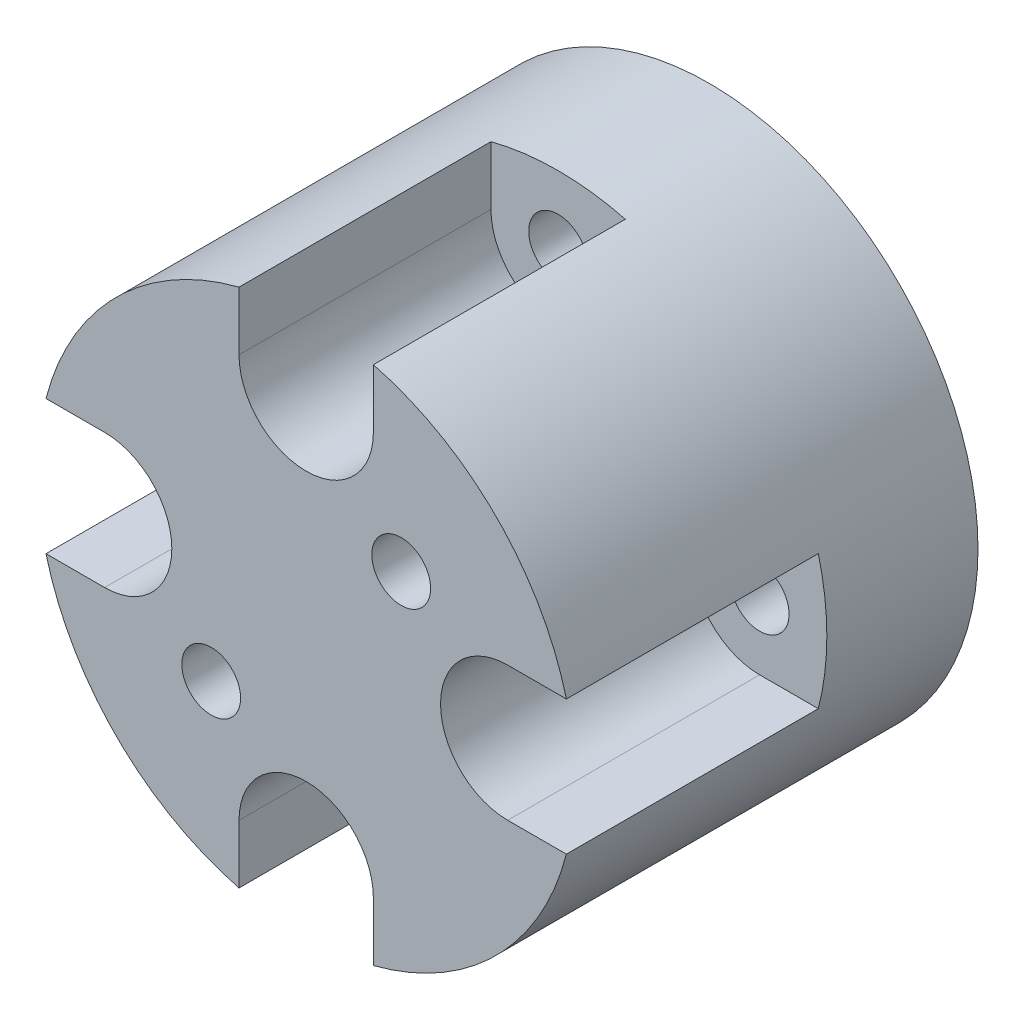
from build123d import *

# Parameters (mm, degrees)
SKETCH1_R           = 16
SKETCH1_R_2         = 1.75
BOSS_EXTRUDE1_DEPTH = 24
SKETCH2_R           = 1.75
CUT_EXTRUDE1_DEPTH  = 33.984845005
SKETCH3_R           = 4
CUT_EXTRUDE2_DEPTH  = 15
CUT_EXTRUDE3_DEPTH  = 15


with BuildPart() as part:
    # Sketch1 → Boss-Extrude1 (new body)
    with BuildSketch(Plane.XY):
        Circle(SKETCH1_R)
        with Locations((0, 12)):
            Circle(SKETCH1_R_2, mode=Mode.SUBTRACT)
        with Locations((12, 0)):
            Circle(SKETCH1_R_2, mode=Mode.SUBTRACT)
        with Locations(Location((-12, 0, 0), (0, 0, 180))):
            Circle(SKETCH1_R_2, mode=Mode.SUBTRACT)
        with Locations(Location((0, -12, 0), (0, 0, 180))):
            Circle(SKETCH1_R_2, mode=Mode.SUBTRACT)
    extrude(amount=BOSS_EXTRUDE1_DEPTH)

    # Sketch2 → Cut-Extrude1 (cut, through all)
    with BuildSketch(Plane(origin=(0, 0, 0), x_dir=(-1, 0, 0), z_dir=(0, 0, -1))):
        with Locations((-5.656854249, 5.656854249)):
            Circle(SKETCH2_R)
        with Locations(Location((5.656854249, -5.656854249, 0), (0, 0, 180))):
            Circle(SKETCH2_R)
    extrude(amount=-CUT_EXTRUDE1_DEPTH, mode=Mode.SUBTRACT)

    # Sketch3 → Cut-Extrude2 (cut)
    with BuildSketch(Plane(origin=(0, 0, 0), x_dir=(-1, 0, 0), z_dir=(0, 0, -1))):
        with Locations((-5.656854249, 5.656854249)):
            Circle(SKETCH3_R)
        with Locations((5.656854249, -5.656854249)):
            Circle(SKETCH3_R)
    extrude(amount=-CUT_EXTRUDE2_DEPTH, mode=Mode.SUBTRACT)

    # Sketch4 → Cut-Extrude3 (cut)
    with BuildSketch(Plane.XY.offset(24)):
        with BuildLine():
            Line((-4, 12), (-4, 19.527532163))
            Line((-4, 19.527532163), (4, 19.527532163))
            Line((4, 19.527532163), (4, 12))
            ThreePointArc((4, 12), (0, 8), (-4, 12))
        make_face()
        with BuildLine():
            Line((12, 4), (20.319785819, 4))
            Line((20.319785819, 4), (20.319785819, -4))
            Line((20.319785819, -4), (12, -4))
            ThreePointArc((12, -4), (8, 0), (12, 4))
        make_face()
        with BuildLine():
            Line((-12, 4), (-20.860663916, 4))
            Line((-20.860663916, 4), (-20.860663916, -4))
            Line((-20.860663916, -4), (-12, -4))
            ThreePointArc((-12, -4), (-8, 0), (-12, 4))
        make_face()
        with BuildLine():
            Line((-4, -12), (-4, -17.609746143))
            Line((-4, -17.609746143), (4, -17.609746143))
            Line((4, -17.609746143), (4, -12))
            ThreePointArc((4, -12), (0, -8), (-4, -12))
        make_face()
    extrude(amount=-CUT_EXTRUDE3_DEPTH, mode=Mode.SUBTRACT)


solid = part.part
